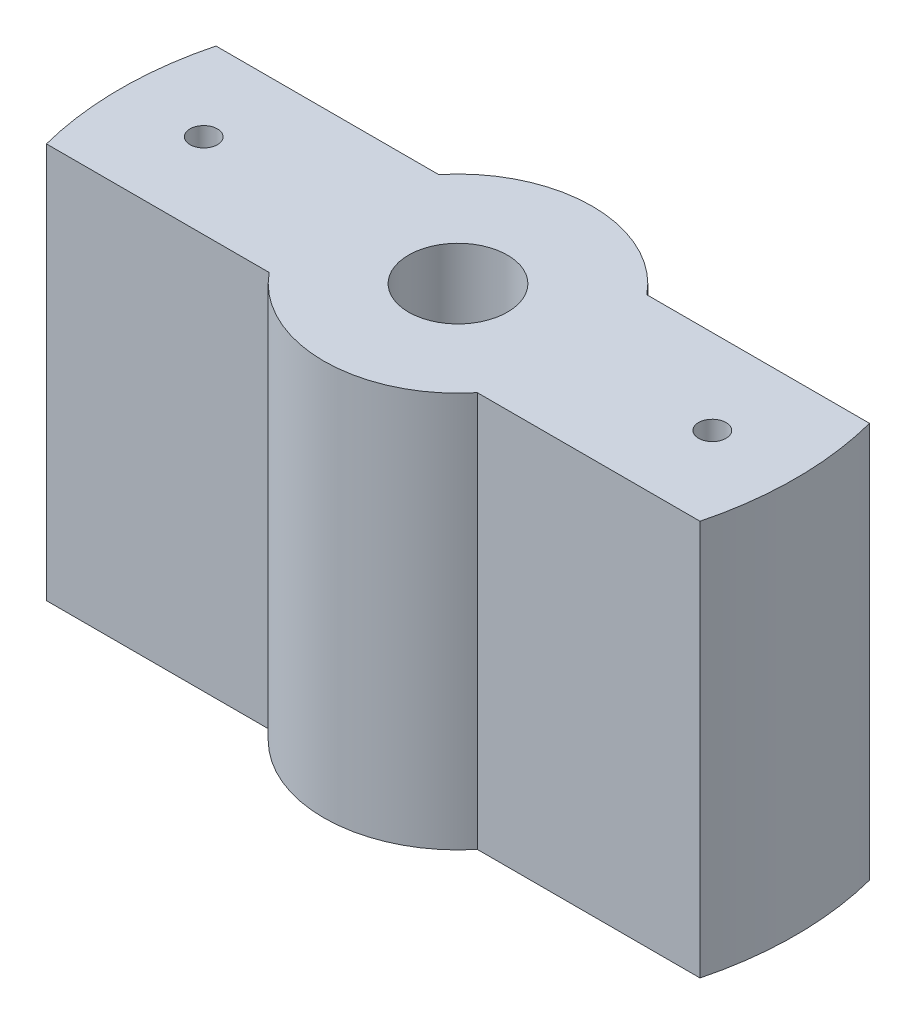
from build123d import *

# Parameters (mm, degrees)
SKETCH_1_R      = 11.1125
SKETCH_1_R_2    = 3.084022448
EXTRUDE_1_DEPTH = 88.9


with BuildPart() as part:
    # Эскиз1 → Бобышка-Вытянуть1 (new body)
    with BuildSketch(Plane(origin=(0, 0, 0), x_dir=(1, 0, 0), z_dir=(0, 1, 0))):
        with BuildLine():
            Line((73.439254163, -13.186564551), (23.385335282, -13.186564551))
            ThreePointArc((23.385335282, -13.186564551), (0, -24.299064551), (-23.385335282, -13.186564551))
            Line((-23.385335282, -13.186564551), (-73.439254163, -13.186564551))
            ThreePointArc((-73.439254163, -13.186564551), (-75.8698, 5.863435449), (-73.439254163, 24.913435449))
            Line((-73.439254163, 24.913435449), (-23.385335282, 24.913435449))
            ThreePointArc((-23.385335282, 24.913435449), (0, 36.025935449), (23.385335282, 24.913435449))
            Line((23.385335282, 24.913435449), (73.439254163, 24.913435449))
            ThreePointArc((73.439254163, 24.913435449), (75.8698, 5.863435449), (73.439254163, -13.186564551))
        make_face()
        with Locations(Location((0, 5.863435449, 0), (0, 0, 270))):
            Circle(SKETCH_1_R, mode=Mode.SUBTRACT)
        with Locations(Location((-57.15, 5.863435449, 0), (0, 0, 270))):
            Circle(SKETCH_1_R_2, mode=Mode.SUBTRACT)
        with Locations(Location((57.15, 5.863435449, 0), (0, 0, 90))):
            Circle(SKETCH_1_R_2, mode=Mode.SUBTRACT)
    extrude(amount=EXTRUDE_1_DEPTH)


solid = part.part
